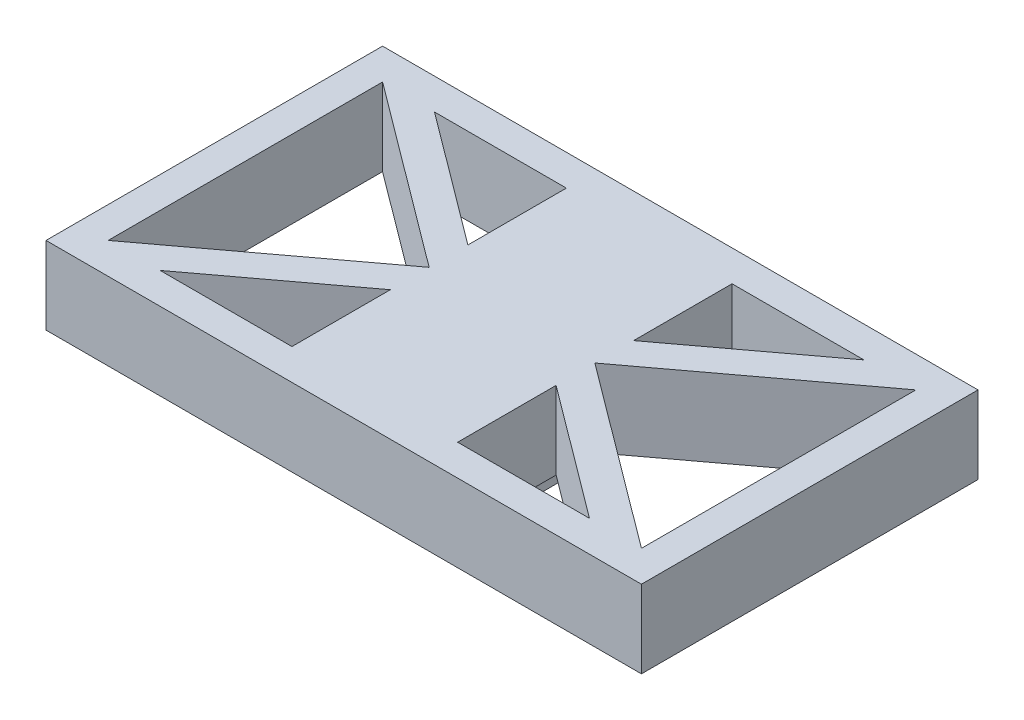
from build123d import *

# Parameters (mm, degrees)
SKETCH1_W           = 58.42
SKETCH1_H           = 33.02
BOSS_EXTRUDE1_DEPTH = 7.62
BOSS_EXTRUDE2_DEPTH = 3.81
CUT_EXTRUDE1_DEPTH  = 35.407391648


with BuildPart() as part:
    # Sketch1 → Boss-Extrude1 (new body)
    with BuildSketch(Plane(origin=(0, 0, 0), x_dir=(1, 0, 0), z_dir=(0, 1, 0))):
        Rectangle(SKETCH1_W, SKETCH1_H)
    extrude(amount=BOSS_EXTRUDE1_DEPTH)

    # Sketch2 → Boss-Extrude2 (add)
    with BuildSketch(Plane.XZ):
        Polygon((5.08, -2.932939367), (5.08, 2.932939367), (0, 5.865878735), (-5.08, 2.932939367), (-5.08, -2.932939367), (0, -5.865878735), align=None)
    extrude(amount=BOSS_EXTRUDE2_DEPTH)

    # Sketch3 → Cut-Extrude1 (cut, through all)
    with BuildSketch(Plane(origin=(0, 0, 0), x_dir=(-1, 0, 0), z_dir=(0, -1, 0))):
        Polygon((26.162, -13.462), (26.162, 13.462), (8.128, 0), align=None)
        Polygon((8.128, -13.462), (21.066651169, -13.462), (8.128, -3.803570254), align=None)
        Polygon((21.066651169, 13.462), (8.128, 3.803570254), (8.128, 13.462), align=None)
        Polygon((-21.066651169, -13.462), (-8.128, -3.803570254), (-8.128, -13.462), align=None)
        Polygon((-8.128, 13.462), (-21.066651169, 13.462), (-8.128, 3.803570254), align=None)
        Polygon((-8.128, 0), (-26.162, -13.462), (-26.162, 13.462), align=None)
    extrude(amount=-CUT_EXTRUDE1_DEPTH, mode=Mode.SUBTRACT)


solid = part.part
